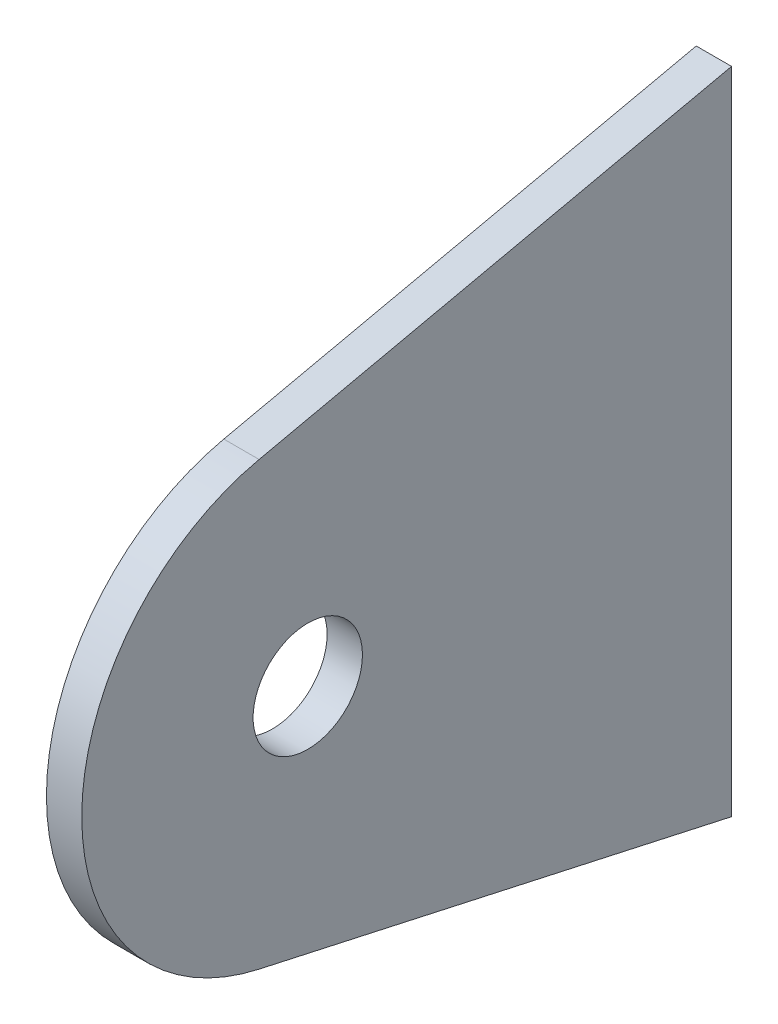
from build123d import *

# Parameters (mm, degrees)
BOSS_EXTRUDE1_DEPTH   = 0.79375
F_8_CLEARANCE_HOLE1_D = 4.9149


with BuildPart() as part:
    # Sketch1 → Boss-Extrude1 (new, symmetric)
    with BuildSketch(Plane(origin=(0, 0, 0), x_dir=(0, 0, -1), z_dir=(1, 0, 0))):
        with BuildLine():
            Line((-2.187912376, 9.921624838), (19.05, 14.605))
            Line((19.05, 14.605), (19.05, -14.605))
            Line((19.05, -14.605), (-2.187912376, -9.921624838))
            ThreePointArc((-2.187912376, -9.921624838), (-10.16, 0), (-2.187912376, 9.921624838))
        make_face()
    extrude(amount=BOSS_EXTRUDE1_DEPTH, both=True)

    # #8 Clearance Hole1 (through all)
    with Locations(Plane(origin=(0.79375, 0, 0), x_dir=(0, 0, -1), z_dir=(1, 0, 0))):
        with Locations((0, 0)):
            Hole(F_8_CLEARANCE_HOLE1_D / 2)


solid = part.part
